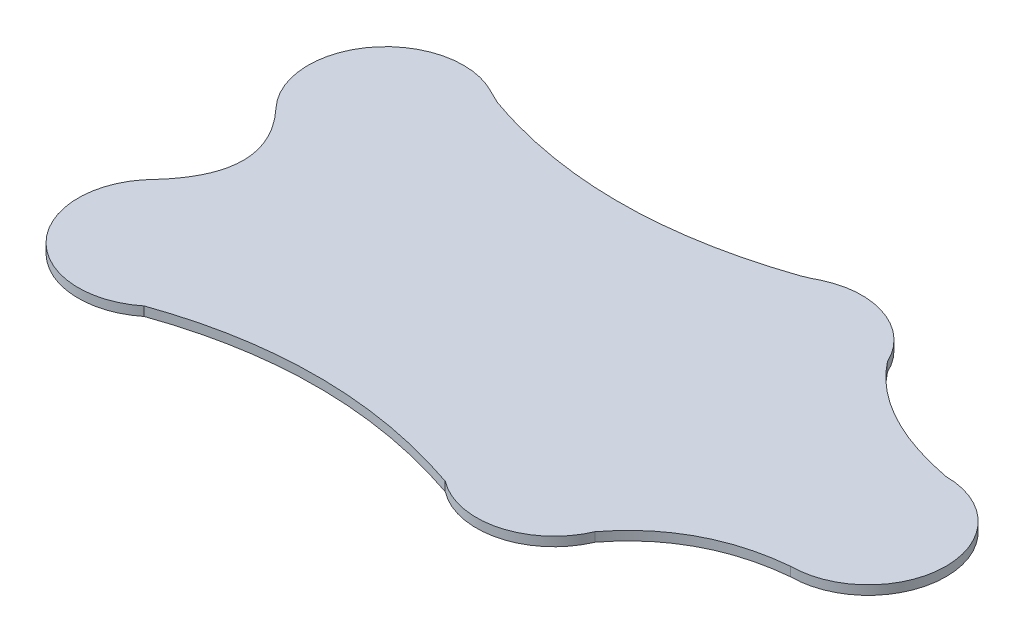
from build123d import *

# Parameters (mm, degrees)
BOSS_EXTRUDE1_DEPTH = 1


with BuildPart() as part:
    # Sketch2 → Boss-Extrude1 (new body)
    with BuildSketch(Plane(origin=(0, 0, 0), x_dir=(1, 0, 0), z_dir=(0, 1, 0))):
        with BuildLine():
            ThreePointArc((-71.182941142, 30.946937821), (-81.955848591, 28.641140782), (-81.404021294, 17.638062962))
            add(Edge.make_bspline(
                [(-81.404021294, 17.638062962), (-75.158372689, 11.002477672), (-81.269993216, 4.278841868)],
                knots=[0, 0, 0, 1, 1, 1], degree=2))
            ThreePointArc((-81.269993216, 4.278841868), (-81.514487403, -7.392298406), (-69.876184196, -8.300698737))
            add(Edge.make_bspline(
                [(-69.876184196, -8.300698737), (-53.789538282, -2.613370983), (-36.816188666, -8.438615516)],
                knots=[0, 0, 0, 1, 1, 1], degree=2))
            ThreePointArc((-36.816188666, -8.438615516), (-29.490215818, -9.906272337), (-23.835645267, -5.022654149))
            add(Edge.make_bspline(
                [(-23.835645267, -5.022654149), (-18.788732993, 1.551574281), (-9.872887068, 2.388856726)],
                knots=[0, 0, 0, 1, 1, 1], degree=2))
            ThreePointArc((-9.872887068, 2.388856726), (-1.372887068, 10.888856726), (-9.872887068, 19.388856726))
            add(Edge.make_bspline(
                [(-23.953041345, 27.063033935), (-19.355695248, 21.203284709), (-9.872887068, 19.388856726)],
                knots=[0, 0, 0, 1, 1, 1], degree=2))
            ThreePointArc((-23.953041345, 27.063033935), (-28.762275622, 31.45705694), (-35.26963246, 31.156258864))
            add(Edge.make_bspline(
                [(-36.816188666, 30.443570859), (-36.021895681, 30.755550467), (-35.26963246, 31.156258864)],
                knots=[0, 0, 0, 1, 1, 1], degree=2))
            add(Edge.make_bspline(
                [(-69.876184196, 30.30565408), (-53.789538282, 24.618326327), (-36.816188666, 30.443570859)],
                knots=[0, 0, 0, 1, 1, 1], degree=2))
            add(Edge.make_bspline(
                [(-69.876184196, 30.30565408), (-70.653281817, 30.689868104), (-71.182941142, 30.946937821)],
                knots=[0, 0, 0, 1, 1, 1], degree=2))
        make_face()
    extrude(amount=BOSS_EXTRUDE1_DEPTH)


solid = part.part
